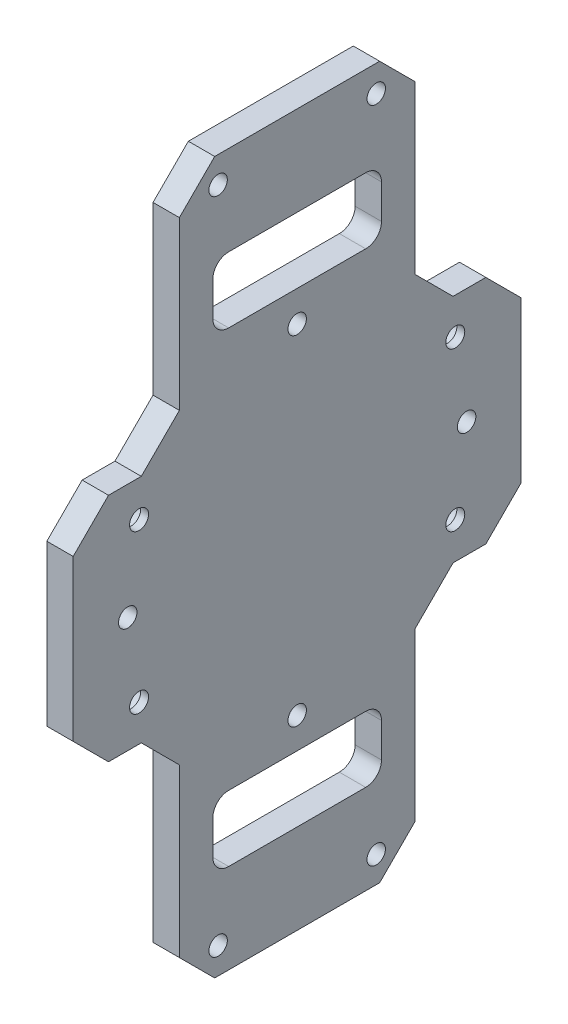
from build123d import *

# Parameters (mm, degrees)
SKETCH1_R           = 1.75
SKETCH1_R_2         = 1.798521792
BOSS_EXTRUDE1_DEPTH = 5
SKETCH2_R           = 2.65
CUT_EXTRUDE1_DEPTH  = 3.5


with BuildPart() as part:
    # Sketch1 → Boss-Extrude1 (new body)
    with BuildSketch(Plane.YZ):
        Polygon((-67.5, -15.65), (-67.5, 15.65), (-60.8, 22.35), (-29.12737367, 22.35), (-21.9, 29.57737367), (-21.9, 35.8), (-15.2, 42.5), (15.2, 42.5), (21.9, 35.8), (21.9, 29.57737367), (29.12737367, 22.35), (60.8, 22.35), (67.5, 15.65), (67.5, -15.65), (60.8, -22.35), (29.12737367, -22.35), (21.9, -29.57737367), (21.9, -35.8), (15.2, -42.5), (-15.2, -42.5), (-21.9, -35.8), (-21.9, -29.57737367), (-29.12737367, -22.35), (-60.8, -22.35), align=None)
        with Locations(Location((0, 32.15, 0), (0, 0, 270))):
            Circle(SKETCH1_R, mode=Mode.SUBTRACT)
        with Locations(Location((-32.15, 0, 0), (0, 0, 270))):
            Circle(SKETCH1_R, mode=Mode.SUBTRACT)
        with Locations(Location((0, -32.15, 0), (0, 0, 270))):
            Circle(SKETCH1_R, mode=Mode.SUBTRACT)
        with Locations(Location((32.15, 0, 0), (0, 0, 270))):
            Circle(SKETCH1_R, mode=Mode.SUBTRACT)
        with Locations(Location((-62.5, -15, 0), (0, 0, 270))):
            Circle(SKETCH1_R, mode=Mode.SUBTRACT)
        with Locations(Location((-62.5, 15, 0), (0, 0, 270))):
            Circle(SKETCH1_R, mode=Mode.SUBTRACT)
        with Locations(Location((62.5, -15, 0), (0, 0, 90))):
            Circle(SKETCH1_R, mode=Mode.SUBTRACT)
        with Locations(Location((62.5, 15, 0), (0, 0, 90))):
            Circle(SKETCH1_R, mode=Mode.SUBTRACT)
        with Locations(Location((-15, 30, 0), (0, 0, 270))):
            Circle(SKETCH1_R_2, mode=Mode.SUBTRACT)
        with Locations(Location((15, 30, 0), (0, 0, 270))):
            Circle(SKETCH1_R_2, mode=Mode.SUBTRACT)
        with Locations(Location((15, -30, 0), (0, 0, 270))):
            Circle(SKETCH1_R_2, mode=Mode.SUBTRACT)
        with Locations(Location((-15, -30, 0), (0, 0, 270))):
            Circle(SKETCH1_R_2, mode=Mode.SUBTRACT)
        with BuildLine():
            Line((41, -16), (47.5, -16))
            ThreePointArc((47.5, -16), (49.621320344, -15.121320344), (50.5, -13))
            Line((50.5, -13), (50.5, 13))
            ThreePointArc((50.5, 13), (49.621320344, 15.121320344), (47.5, 16))
            Line((47.5, 16), (41, 16))
            ThreePointArc((41, 16), (38.878679656, 15.121320344), (38, 13))
            Line((38, 13), (38, -13))
            ThreePointArc((38, -13), (38.878679656, -15.121320344), (41, -16))
        make_face(mode=Mode.SUBTRACT)
        with BuildLine():
            Line((-41, -16), (-47.5, -16))
            ThreePointArc((-47.5, -16), (-49.621320344, -15.121320344), (-50.5, -13))
            Line((-50.5, -13), (-50.5, 13))
            ThreePointArc((-50.5, 13), (-49.621320344, 15.121320344), (-47.5, 16))
            Line((-47.5, 16), (-41, 16))
            ThreePointArc((-41, 16), (-38.878679656, 15.121320344), (-38, 13))
            Line((-38, 13), (-38, -13))
            ThreePointArc((-38, -13), (-38.878679656, -15.121320344), (-41, -16))
        make_face(mode=Mode.SUBTRACT)
    extrude(amount=BOSS_EXTRUDE1_DEPTH)

    # Sketch2 → Cut-Extrude1 (cut)
    with BuildSketch(Plane(origin=(0, 0, 0), x_dir=(0, -1, 0), z_dir=(-1, 0, 0))):
        with Locations(Location((-15, 30, 0), (0, 0, 90))):
            Circle(SKETCH2_R)
        with Locations(Location((15, 30, 0), (0, 0, 90))):
            Circle(SKETCH2_R)
        with Locations(Location((15, -30, 0), (0, 0, 90))):
            Circle(SKETCH2_R)
        with Locations(Location((-15, -30, 0), (0, 0, 90))):
            Circle(SKETCH2_R)
    extrude(amount=-CUT_EXTRUDE1_DEPTH, mode=Mode.SUBTRACT)


solid = part.part
